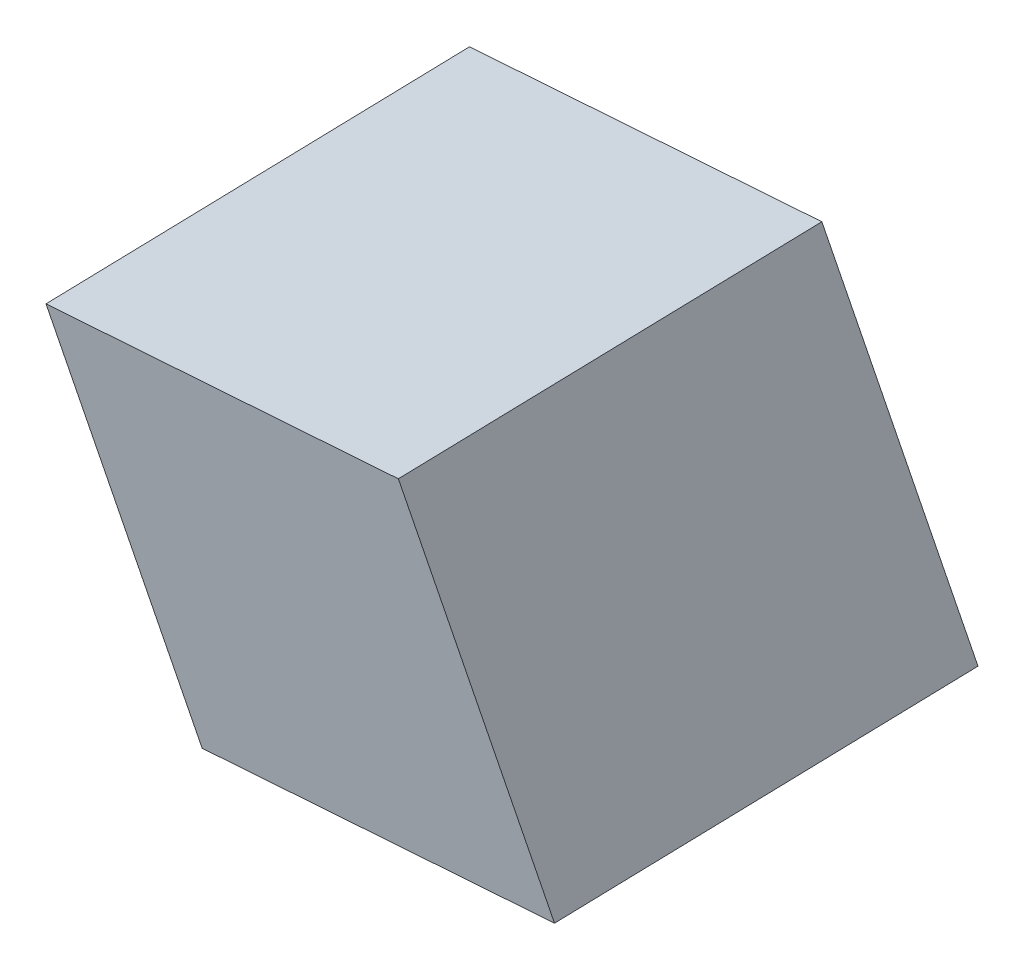
from build123d import *

# Parameters (mm, degrees)
SKETCH_1_W      = 400
SKETCH_1_H      = 400
EXTRUDE_1_DEPTH = 500


with BuildPart() as part:
    # Эскиз1 → Бобышка-Вытянуть1 (new body)
    with BuildSketch(Plane(origin=(-58.634542877, 370.763134802, -91.870721995), x_dir=(0.27988847689623686, -0.9504772644957356, -0.13511258334221965), z_dir=(0.9474942839625831, 0.2508123545437093, 0.19836265945603984))):
        with Locations((-185.56016026, 180.64165195)):
            Rectangle(SKETCH_1_W, SKETCH_1_H)
    extrude(amount=-EXTRUDE_1_DEPTH)


solid = part.part
